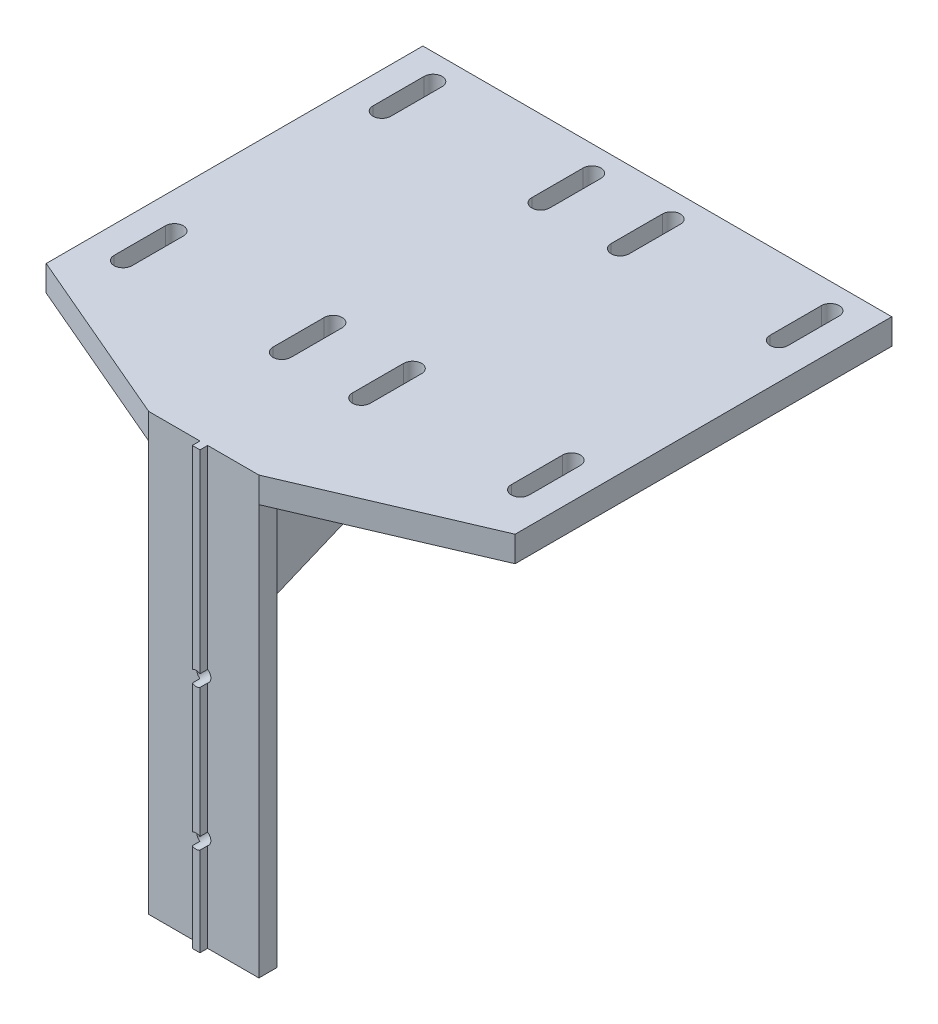
from build123d import *

# Parameters (mm, degrees)
SKETCH_1_W                   = 43
SKETCH_1_H                   = 170
EXTRUDE_296_DEPTH            = 7
SKETCH_2_W                   = 3
SKETCH_2_H                   = 170
EXTRUDE_513_DEPTH            = 3
HOLE_WIZARD_M5_2_D           = 5.5
HOLE_WIZARD_M5_2_CSINK_D     = 11.2
HOLE_WIZARD_M5_2_CSINK_ANGLE = 90
SKETCH_9_W                   = 183
SKETCH_9_H                   = 10
EXTRUDE_1613_DEPTH           = 170
SKETCH_10_W                  = 183
SKETCH_10_H                  = 10
EXTRUDE_1772_DEPTH           = 7
EXTRUDE_3_DEPTH              = 10
EXTRUDE_3_DEPTH_BACK         = 10
CUT_EXTRUDE_1_DEPTH          = 258.239674234
MIRROR_2_COPY_1_DEPTH        = 258.239674234
CUT_EXTRUDE_2_DEPTH          = 10
MIRROR_3_COPY_1_DEPTH        = 258.239674234
MIRROR_3_COPY_2_DEPTH        = 258.239674234
MIRROR_3_COPY_3_DEPTH        = 258.239674234


with BuildPart() as part:
    # 草图1 → Extrude 296 (new body)
    with BuildSketch(Plane.XY):
        Rectangle(SKETCH_1_W, SKETCH_1_H)
    extrude(amount=EXTRUDE_296_DEPTH)

    # 草图2 → Extrude 513 (add)
    with BuildSketch(Plane.XY.offset(7)):
        Rectangle(SKETCH_2_W, SKETCH_2_H)
    extrude(amount=EXTRUDE_513_DEPTH)

    # M5*2 沉头孔 (through all)
    with Locations(Plane(origin=(0, 0, 0), x_dir=(-1, 0, 0), z_dir=(0, 0, -1))):
        with Locations((0, 7), (0, -48)):
            CounterSinkHole(HOLE_WIZARD_M5_2_D / 2, HOLE_WIZARD_M5_2_CSINK_D / 2, counter_sink_angle=HOLE_WIZARD_M5_2_CSINK_ANGLE)

    # 草图9 → Extrude 1613 (add)
    with BuildSketch(Plane(origin=(0, 0, 0), x_dir=(-1, 0, 0), z_dir=(0, 0, -1))):
        with Locations((0, 80)):
            Rectangle(SKETCH_9_W, SKETCH_9_H)
    extrude(amount=EXTRUDE_1613_DEPTH)

    # 草图10 → Extrude 1772 (add)
    with BuildSketch(Plane.XY):
        with Locations((0, 80)):
            Rectangle(SKETCH_10_W, SKETCH_10_H)
    extrude(amount=EXTRUDE_1772_DEPTH)

    # 草图11 → 凸台-拉伸3 (add, two sides: drawn at the far end of the back side and taken through both)
    with BuildSketch(Plane(origin=(0, 0, 0), x_dir=(0, 0, -1), z_dir=(1, 0, 0)).offset(-EXTRUDE_3_DEPTH_BACK)):
        Polygon((0, 74.965878979), (0, 24.965878979), (120, 74.965878979), align=None)
    extrude(amount=EXTRUDE_3_DEPTH + EXTRUDE_3_DEPTH_BACK)

    # 草图12 → 切除-拉伸1 (cut, through all)
    with BuildSketch(Plane(origin=(0, 85, 0), x_dir=(1, 0, 0), z_dir=(0, 1, 0))):
        with BuildLine():
            Line((-74, 160), (-74, 140))
            ThreePointArc((-74, 140), (-77.5, 136.5), (-81, 140))
            Line((-81, 140), (-81, 160))
            ThreePointArc((-81, 160), (-77.5, 163.5), (-74, 160))
        make_face()
    cut_extrude_1 = extrude(amount=-CUT_EXTRUDE_1_DEPTH, mode=Mode.SUBTRACT)

    # 镜向1: 切除-拉伸1 across plane
    add(cut_extrude_1.mirror(Plane.XY.offset(-99.5)), mode=Mode.SUBTRACT)

    # 镜向2: 切除-拉伸1 across plane
    add(cut_extrude_1.mirror(Plane.ZY.offset(46.5)), mode=Mode.SUBTRACT)

    # 镜向2 copy 1 sketch → 镜向2 copy 1 (cut, through all)
    with BuildSketch(Plane(origin=(-93, 85, -199), x_dir=(-1, 0, 0), z_dir=(0, 1, 0))):
        with BuildLine():
            Line((-74, 160), (-74, 140))
            ThreePointArc((-74, 140), (-77.5, 136.5), (-81, 140))
            Line((-81, 140), (-81, 160))
            ThreePointArc((-81, 160), (-77.5, 163.5), (-74, 160))
        make_face()
    extrude(amount=-MIRROR_2_COPY_1_DEPTH, mode=Mode.SUBTRACT)

    # 草图13 → 切除-拉伸2 (cut)
    with BuildSketch(Plane(origin=(0, 85, 0), x_dir=(1, 0, 0), z_dir=(0, 1, 0))):
        Polygon((-91.5, -7), (-21.5, -7), (-91.5, 23), align=None)
    cut_extrude_2 = extrude(amount=-CUT_EXTRUDE_2_DEPTH, mode=Mode.SUBTRACT)

    # 镜向3: 切除-拉伸1, 切除-拉伸2 across plane
    add(cut_extrude_1.mirror(Plane(origin=(0, 0, 0), x_dir=(0, 0, 1), z_dir=(1, 0, 0))), mode=Mode.SUBTRACT)
    add(cut_extrude_2.mirror(Plane(origin=(0, 0, 0), x_dir=(0, 0, 1), z_dir=(1, 0, 0))), mode=Mode.SUBTRACT)

    # 镜向3 copy 1 sketch → 镜向3 copy 1 (cut, through all)
    with BuildSketch(Plane(origin=(0, 85, -199), x_dir=(-1, 0, 0), z_dir=(0, 1, 0))):
        with BuildLine():
            Line((-74, 160), (-74, 140))
            ThreePointArc((-74, 140), (-77.5, 136.5), (-81, 140))
            Line((-81, 140), (-81, 160))
            ThreePointArc((-81, 160), (-77.5, 163.5), (-74, 160))
        make_face()
    extrude(amount=-MIRROR_3_COPY_1_DEPTH, mode=Mode.SUBTRACT)

    # 镜向3 copy 2 sketch → 镜向3 copy 2 (cut, through all)
    with BuildSketch(Plane(origin=(93, 85, 0), x_dir=(1, 0, 0), z_dir=(0, 1, 0))):
        with BuildLine():
            Line((-74, 160), (-74, 140))
            ThreePointArc((-74, 140), (-77.5, 136.5), (-81, 140))
            Line((-81, 140), (-81, 160))
            ThreePointArc((-81, 160), (-77.5, 163.5), (-74, 160))
        make_face()
    extrude(amount=-MIRROR_3_COPY_2_DEPTH, mode=Mode.SUBTRACT)

    # 镜向3 copy 3 sketch → 镜向3 copy 3 (cut, through all)
    with BuildSketch(Plane(origin=(93, 85, -199), x_dir=(1, 0, 0), z_dir=(0, 1, 0))):
        with BuildLine():
            Line((-74, -160), (-74, -140))
            ThreePointArc((-74, -140), (-77.5, -136.5), (-81, -140))
            Line((-81, -140), (-81, -160))
            ThreePointArc((-81, -160), (-77.5, -163.5), (-74, -160))
        make_face()
    extrude(amount=-MIRROR_3_COPY_3_DEPTH, mode=Mode.SUBTRACT)


solid = part.part
